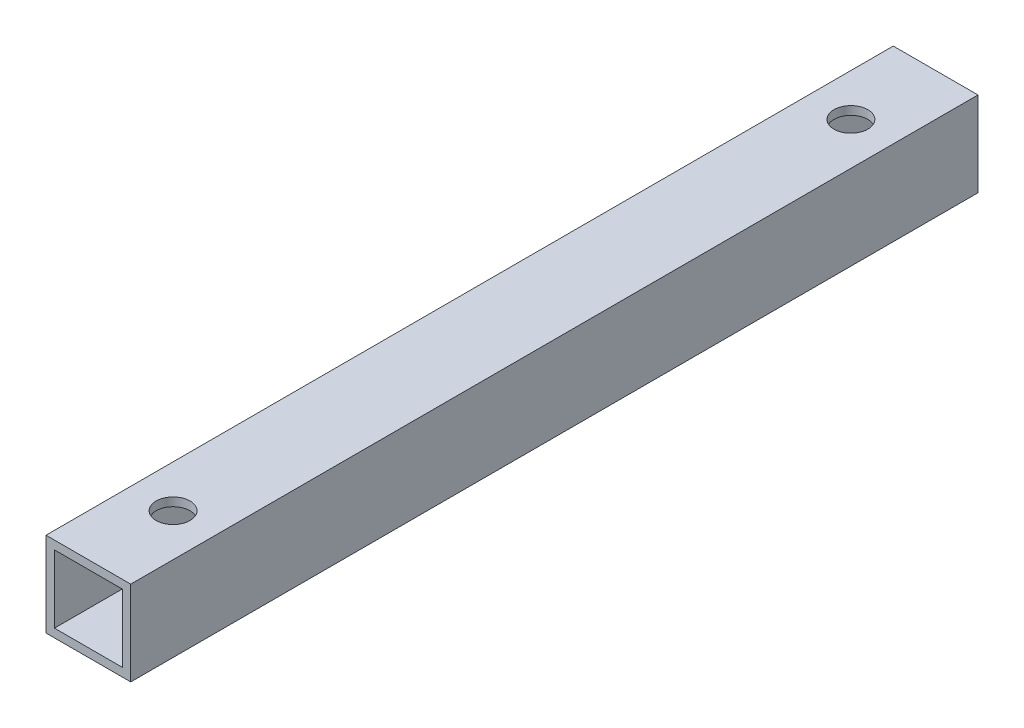
from build123d import *

# Parameters (mm, degrees)
SKETCH_1_W          = 8
SKETCH_1_H          = 8
EXTRUDE_1_DEPTH     = 100
SKETCH_2_R          = 2
CUT_EXTRUDE_1_DEPTH = 104


with BuildPart() as part:
    # 草图1 → 凸台-拉伸1 (new body)
    with BuildSketch(Plane.XY):
        Polygon((-1, 5.896797153), (-1, 9), (9, 9), (9, -1), (-1, -1), align=None)
        with Locations((4, 4)):
            Rectangle(SKETCH_1_W, SKETCH_1_H, mode=Mode.SUBTRACT)
    extrude(amount=EXTRUDE_1_DEPTH)

    # 草图2 → 切除-拉伸1 (cut)
    with BuildSketch(Plane(origin=(0, 9, 0), x_dir=(1, 0, 0), z_dir=(0, 1, 0))):
        with Locations(Location((4, -90, 0), (0, 0, 270))):
            Circle(SKETCH_2_R)
        with Locations(Location((4, -10, 0), (0, 0, 270))):
            Circle(SKETCH_2_R)
    extrude(amount=-CUT_EXTRUDE_1_DEPTH, mode=Mode.SUBTRACT)


solid = part.part
